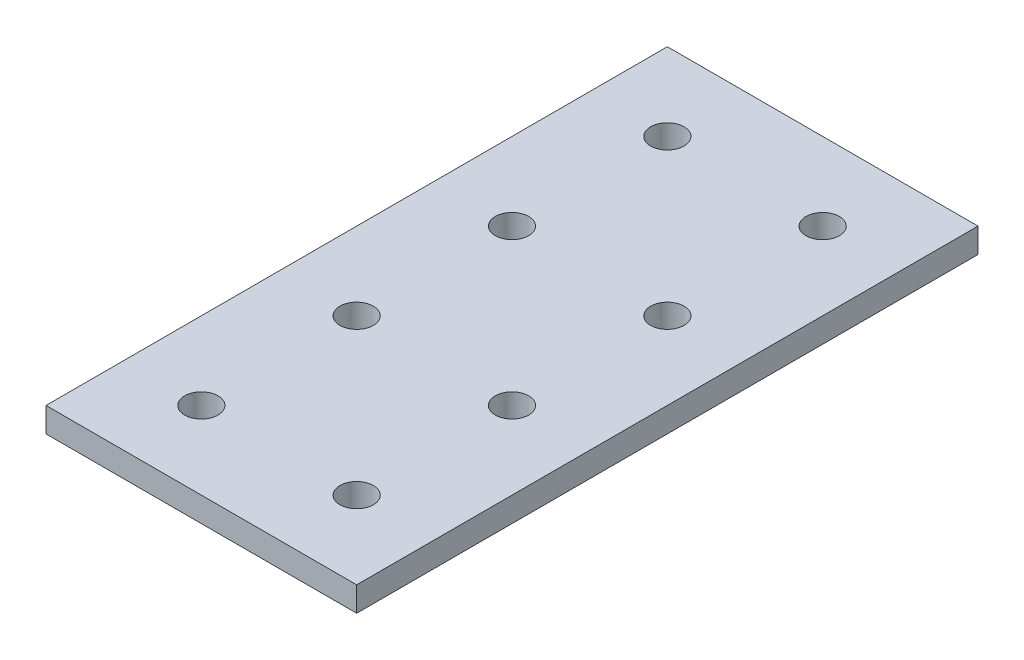
from build123d import *

# Parameters (mm, degrees)
SKETCH1_W            = 40
SKETCH1_H            = 80
BOSS_EXTRUDE1_DEPTH  = 3.175
M4_CLEARANCE_HOLE1_D = 4.3


with BuildPart() as part:
    # Sketch1 → Boss-Extrude1 (new body)
    with BuildSketch(Plane(origin=(0, 0, 0), x_dir=(1, 0, 0), z_dir=(0, 1, 0))):
        with Locations((20, 40)):
            Rectangle(SKETCH1_W, SKETCH1_H)
    extrude(amount=BOSS_EXTRUDE1_DEPTH)

    # M4 Clearance Hole1 (through all)
    with Locations(Plane(origin=(0, 3.175, 0), x_dir=(1, 0, 0), z_dir=(0, 1, 0))):
        with Locations((10, 70), (30, 70), (30, 50), (30, 30), (30, 10), (10, 50), (10, 30), (10, 10)):
            Hole(M4_CLEARANCE_HOLE1_D / 2)


solid = part.part
